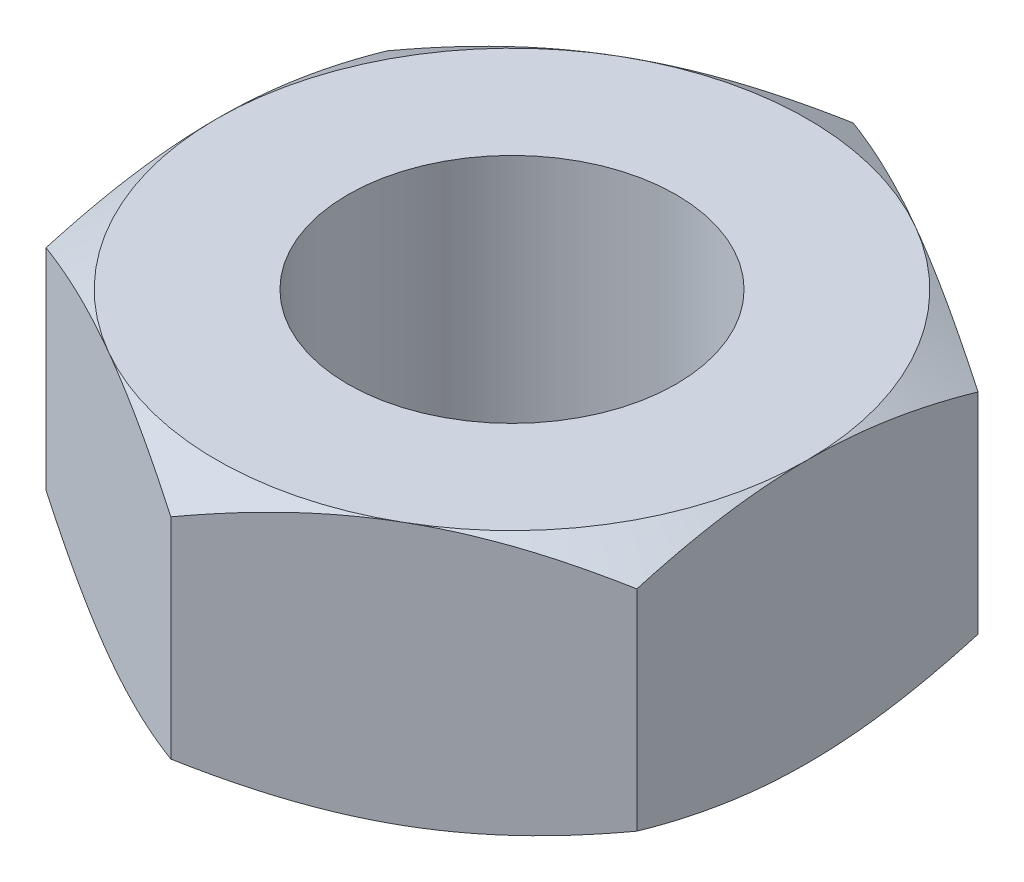
from build123d import *

# Parameters (mm, degrees)
SKETCH1_R           = 1.25
BOSS_EXTRUDE1_DEPTH = 2
SKETCH2_OUTSIDE_W   = 14.86
SKETCH2_OUTSIDE_H   = 15.556
SKETCH2_OUTSIDE_R   = 2.25
CUT_EXTRUDE1_DEPTH  = 2
CUT_EXTRUDE1_DRAFT  = -60
SKETCH3_OUTSIDE_W   = 14.86
SKETCH3_OUTSIDE_H   = 15.556
SKETCH3_OUTSIDE_R   = 2.25
CUT_EXTRUDE2_DEPTH  = 2
CUT_EXTRUDE2_DRAFT  = -60


with BuildPart() as part:
    # Sketch1 → Boss-Extrude1 (new body)
    with BuildSketch(Plane(origin=(0, 0, 0), x_dir=(1, 0, 0), z_dir=(0, 1, 0))):
        Polygon((0, 2.598076211), (-2.25, 1.299038106), (-2.25, -1.299038106), (0, -2.598076211), (2.25, -1.299038106), (2.25, 1.299038106), align=None)
        with Locations(Location((0, 0, 0), (0, 0, 270))):
            Circle(SKETCH1_R, mode=Mode.SUBTRACT)
    extrude(amount=BOSS_EXTRUDE1_DEPTH)


with BuildPart() as cut_extrude1_tool:
    # Sketch2 outside → Cut-Extrude1 (with draft: the straight prism first)
    with BuildSketch(Plane(origin=(0, 2, 0), x_dir=(1, 0, 0), z_dir=(0, 1, 0))):
        Rectangle(SKETCH2_OUTSIDE_W, SKETCH2_OUTSIDE_H)
        Circle(SKETCH2_OUTSIDE_R, mode=Mode.SUBTRACT)
    extrude(amount=-CUT_EXTRUDE1_DEPTH)
    # Cut-Extrude1: the draft: its side faces are tilted about the plane it starts from
    cut_extrude1_sides = [cut_extrude1_tool.faces().sort_by_distance(p)[0] for p in [
        (0, 1, 7.778),
        (7.43, 1, 0),
        (0, 1, -7.778),
        (-7.43, 1, 0),
        (-2.25, 1, 0),
    ]]
    draft(cut_extrude1_sides, Plane(origin=(0, 2, 0), x_dir=(1, 0, 0), z_dir=(0, 1, 0)), CUT_EXTRUDE1_DRAFT)


with BuildPart() as part_1:
    add(part.part)

    # Cut-Extrude1: cut by cut_extrude1_tool
    add(cut_extrude1_tool.part, mode=Mode.SUBTRACT)


with BuildPart() as cut_extrude2_tool:
    # Sketch3 outside → Cut-Extrude2 (with draft: the straight prism first)
    with BuildSketch(Plane.XZ):
        Rectangle(SKETCH3_OUTSIDE_W, SKETCH3_OUTSIDE_H)
        Circle(SKETCH3_OUTSIDE_R, mode=Mode.SUBTRACT)
    extrude(amount=-CUT_EXTRUDE2_DEPTH)
    # Cut-Extrude2: the draft: its side faces are tilted about the plane it starts from
    cut_extrude2_sides = [cut_extrude2_tool.faces().sort_by_distance(p)[0] for p in [
        (0, 1, -7.778),
        (7.43, 1, 0),
        (0, 1, 7.778),
        (-7.43, 1, 0),
        (-2.25, 1, 0),
    ]]
    draft(cut_extrude2_sides, Plane.XZ, CUT_EXTRUDE2_DRAFT)


with BuildPart() as part_2:
    add(part_1.part)

    # Cut-Extrude2: cut by cut_extrude2_tool
    add(cut_extrude2_tool.part, mode=Mode.SUBTRACT)


solid = part_2.part
